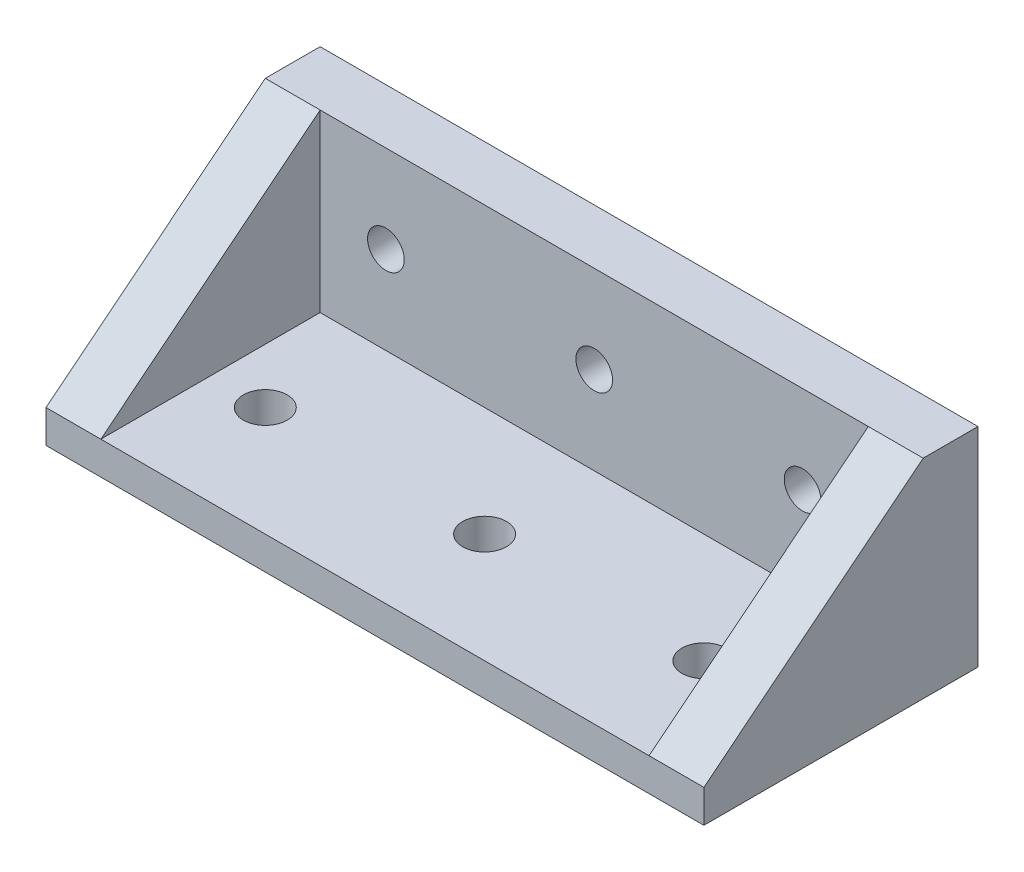
from build123d import *

# Parameters (mm, degrees)
SKETCH1_W           = 60
SKETCH1_H           = 19
BOSS_EXTRUDE1_DEPTH = 5
SKETCH2_W           = 60
SKETCH2_H           = 3
BOSS_EXTRUDE2_DEPTH = 20
BOSS_EXTRUDE3_DEPTH = 5
SKETCH4_R           = 1.67292172
CUT_EXTRUDE1_DEPTH  = 5
SKETCH5_R           = 2
CUT_EXTRUDE2_DEPTH  = 5


with BuildPart() as part:
    # Sketch1 → Boss-Extrude1 (new body)
    with BuildSketch(Plane.XY):
        with Locations((30, -9.5)):
            Rectangle(SKETCH1_W, SKETCH1_H)
    extrude(amount=BOSS_EXTRUDE1_DEPTH)

    # Sketch2 → Boss-Extrude2 (add)
    with BuildSketch(Plane.XY.offset(5)):
        with Locations((30, -17.5)):
            Rectangle(SKETCH2_W, SKETCH2_H)
    extrude(amount=BOSS_EXTRUDE2_DEPTH)

    # Sketch3 → Boss-Extrude3 (add)
    with BuildSketch(Plane(origin=(60, 0, 0), x_dir=(0, 0, -1), z_dir=(1, 0, 0))):
        Polygon((-5, 0), (-25, -16), (-5, -16), align=None)
    boss_extrude3 = extrude(amount=-BOSS_EXTRUDE3_DEPTH)

    # Mirror1: Boss-Extrude3 across plane
    add(boss_extrude3.mirror(Plane(origin=(30, 0, 0), x_dir=(0, 0, 1), z_dir=(1, 0, 0))))

    # Sketch4 → Cut-Extrude1 (cut)
    with BuildSketch(Plane.XY.offset(5)):
        with Locations((11, -8)):
            Circle(SKETCH4_R)
        with Locations((30, -8)):
            Circle(SKETCH4_R)
        with Locations((49, -8)):
            Circle(SKETCH4_R)
    extrude(amount=-CUT_EXTRUDE1_DEPTH, mode=Mode.SUBTRACT)

    # Sketch5 → Cut-Extrude2 (cut)
    with BuildSketch(Plane(origin=(0, -16, 0), x_dir=(1, 0, 0), z_dir=(0, 1, 0))):
        with Locations(Location((10, -15, 0), (0, 0, 270))):
            Circle(SKETCH5_R)
        with Locations(Location((30, -15, 0), (0, 0, 270))):
            Circle(SKETCH5_R)
        with Locations(Location((50, -15, 0), (0, 0, 270))):
            Circle(SKETCH5_R)
    extrude(amount=-CUT_EXTRUDE2_DEPTH, mode=Mode.SUBTRACT)


solid = part.part
